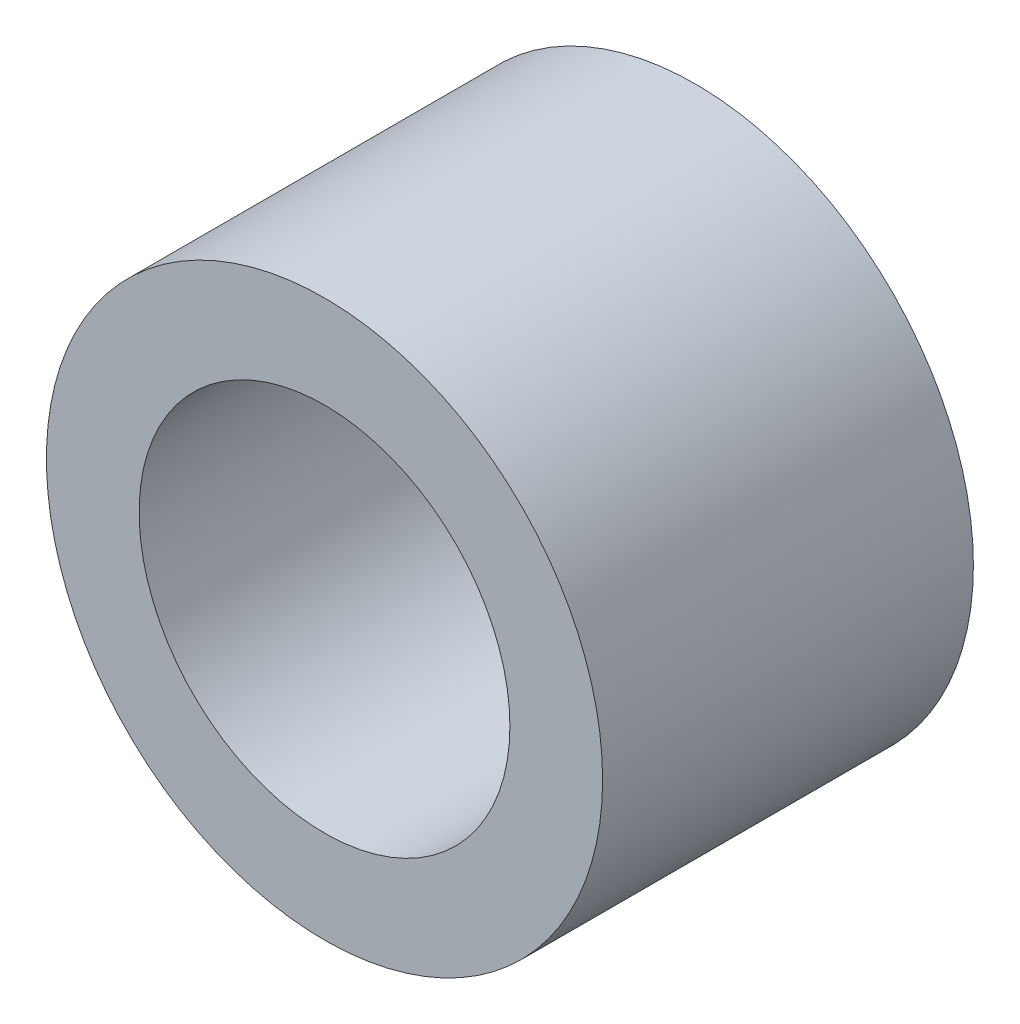
from build123d import *

# Parameters (mm, degrees)
SKETCH1_R           = 9.525
SKETCH1_R_2         = 6.35
BOSS_EXTRUDE2_DEPTH = 12.7


with BuildPart() as part:
    # Sketch1 → Boss-Extrude2 (new body)
    with BuildSketch(Plane.XY):
        Circle(SKETCH1_R)
        Circle(SKETCH1_R_2, mode=Mode.SUBTRACT)
    extrude(amount=BOSS_EXTRUDE2_DEPTH)


solid = part.part
